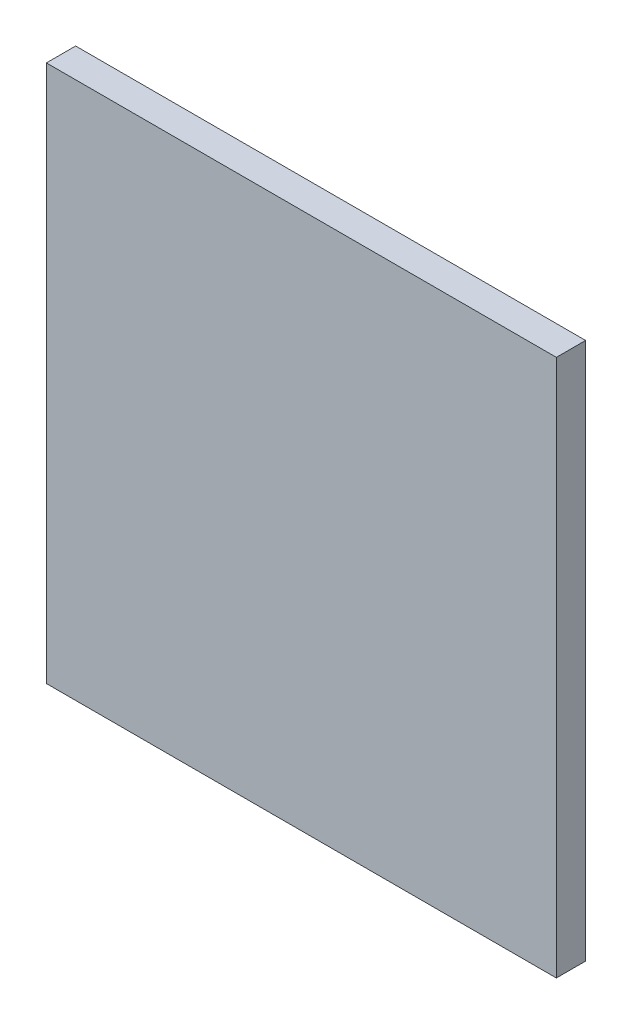
from build123d import *

# Parameters (mm, degrees)
SKETCH2_W           = 332.069895667
SKETCH2_H           = 350
BOSS_EXTRUDE1_DEPTH = 19.05


with BuildPart() as part:
    # Sketch2 → Boss-Extrude1 (new body)
    with BuildSketch(Plane.XY):
        with Locations((88.795456857, -192.59332013)):
            Rectangle(SKETCH2_W, SKETCH2_H)
    extrude(amount=BOSS_EXTRUDE1_DEPTH)


solid = part.part
